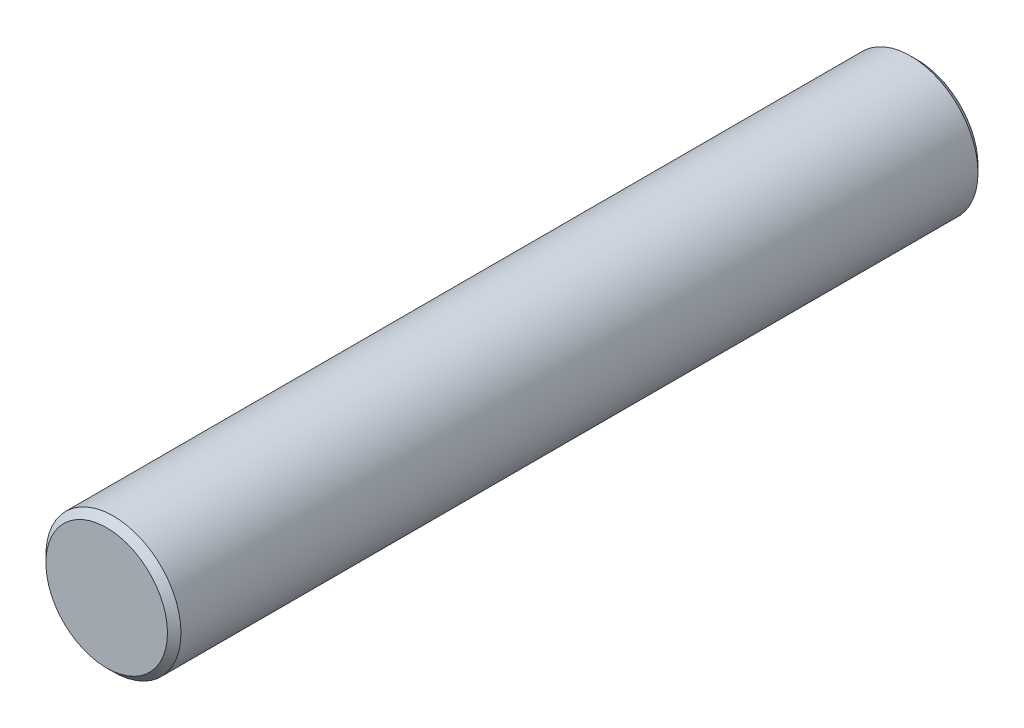
from build123d import *

# Parameters (mm, degrees)
SKETCH2_R           = 2.5
BOSS_EXTRUDE1_DEPTH = 15
CHAMFER1_SIZE       = 0.25


with BuildPart() as part:
    # Sketch2 → Boss-Extrude1 (new, symmetric)
    with BuildSketch(Plane.XY):
        Circle(SKETCH2_R)
    extrude(amount=BOSS_EXTRUDE1_DEPTH, both=True)

    # Chamfer1
    chamfer1_edges = [part.edges().sort_by_distance(p)[0] for p in [
        (-2.5, 0, -15),
        (-2.5, 0, 15),
    ]]
    chamfer(chamfer1_edges, length=CHAMFER1_SIZE)


solid = part.part
